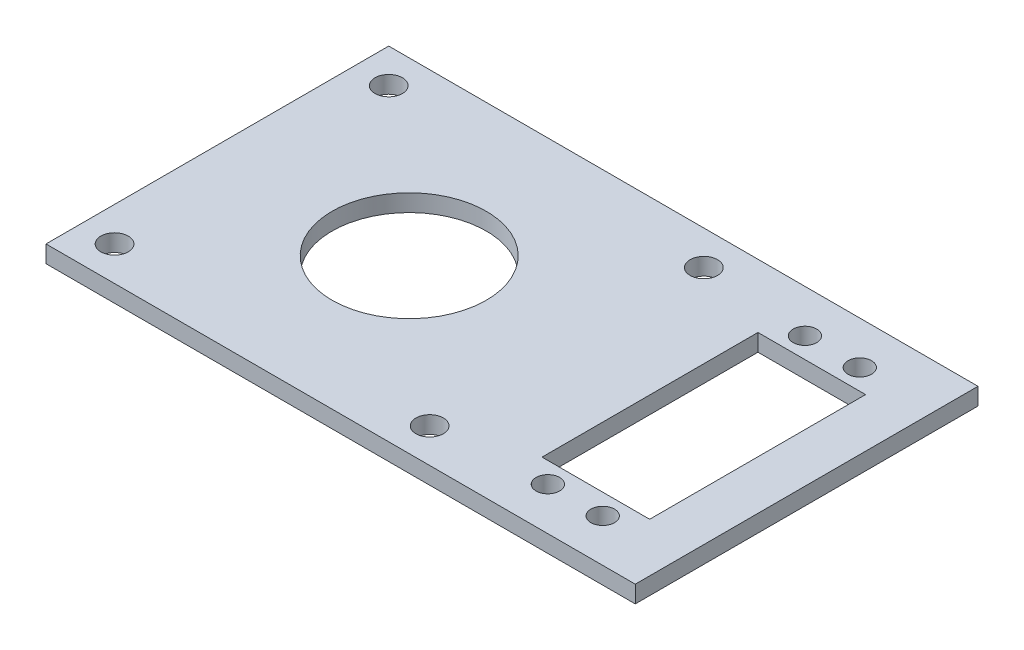
from build123d import *

# Parameters (mm, degrees)
SKETCH2_W           = 38.1
SKETCH2_H           = 63.5
SKETCH2_R           = 2.1844
SKETCH2_W_2         = 19.939
SKETCH2_H_2         = 40.005
BOSS_EXTRUDE1_DEPTH = 3.175
SKETCH4_W           = 71.079825169
SKETCH4_H           = 63.5
SKETCH4_R           = 14.2875
SKETCH4_R_2         = 2.54
BOSS_EXTRUDE3_DEPTH = 3.175


with BuildPart() as part:
    # Sketch2 → Boss-Extrude1 (new body)
    with BuildSketch(Plane(origin=(0, 0, 0), x_dir=(1, 0, 0), z_dir=(0, 1, 0))):
        with Locations((0, -10.3505)):
            Rectangle(SKETCH2_W, SKETCH2_H)
        with Locations(Location((5.08, 13.462, 0), (0, 0, 270))):
            Circle(SKETCH2_R, mode=Mode.SUBTRACT)
        with Locations(Location((-5.08, 13.462, 0), (0, 0, 270))):
            Circle(SKETCH2_R, mode=Mode.SUBTRACT)
        with Locations(Location((-5.08, -34.163, 0), (0, 0, 270))):
            Circle(SKETCH2_R, mode=Mode.SUBTRACT)
        with Locations(Location((5.08, -34.163, 0), (0, 0, 270))):
            Circle(SKETCH2_R, mode=Mode.SUBTRACT)
        with Locations((0, -10.3505)):
            Rectangle(SKETCH2_W_2, SKETCH2_H_2, mode=Mode.SUBTRACT)
    extrude(amount=BOSS_EXTRUDE1_DEPTH)

    # Sketch4 → Boss-Extrude3 (add, through all)
    with BuildSketch(Plane(origin=(0, 3.175, 0), x_dir=(1, 0, 0), z_dir=(0, 1, 0))):
        with Locations((-54.589912584, -10.3505)):
            Rectangle(SKETCH4_W, SKETCH4_H)
        with Locations(Location((-54.589912585, -10.3505, 0), (0, 0, 270))):
            Circle(SKETCH4_R, mode=Mode.SUBTRACT)
        with Locations(Location((-83.779825169, 15.0495, 0), (0, 0, 270))):
            Circle(SKETCH4_R_2, mode=Mode.SUBTRACT)
        with Locations(Location((-25.4, 15.0495, 0), (0, 0, 270))):
            Circle(SKETCH4_R_2, mode=Mode.SUBTRACT)
        with Locations(Location((-25.4, -35.7505, 0), (0, 0, 270))):
            Circle(SKETCH4_R_2, mode=Mode.SUBTRACT)
        with Locations(Location((-83.779825169, -35.7505, 0), (0, 0, 270))):
            Circle(SKETCH4_R_2, mode=Mode.SUBTRACT)
    extrude(amount=-BOSS_EXTRUDE3_DEPTH)


solid = part.part
